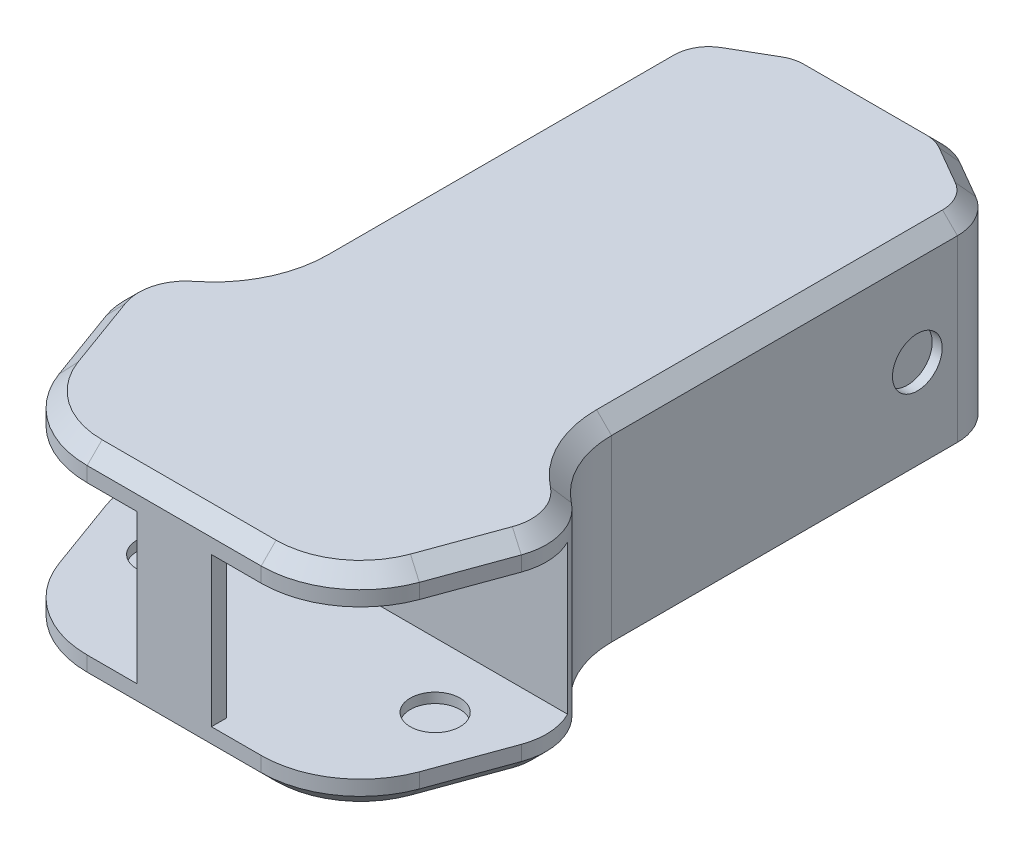
from build123d import *

# Parameters (mm, degrees)
BOSS_EXTRUDE1_DEPTH      = 21
BOSS_EXTRUDE1_DEPTH_BACK = 21
CUT_EXTRUDE2_DEPTH       = 150.699259177
CUT_EXTRUDE2_DEPTH_BACK  = 150.699259177
SKETCH3_W                = 38
SKETCH3_H                = 30
CHAMFER1_SIZE            = 3
BOSS_EXTRUDE2_REACH      = 154.528
SKETCH4_W                = 15
SKETCH4_H                = 3
SKETCH5_R                = 5
CUT_EXTRUDE3_DEPTH       = 2
SKETCH6_R                = 5
CUT_EXTRUDE4_DEPTH       = 2


with BuildPart() as part:
    # Sketch1 → Boss-Extrude1 (new, two sides: drawn at the far end of the back side and taken through both)
    with BuildSketch(Plane(origin=(0, 0, 0), x_dir=(1, 0, 0), z_dir=(0, 1, 0)).offset(-BOSS_EXTRUDE1_DEPTH_BACK)):
        with BuildLine():
            Line((12.320508076, 0), (-12.320508076, 0))
            ThreePointArc((-12.320508076, 0), (-14.908698527, -0.340741737), (-17.320508076, -1.339745962))
            Line((-17.320508076, -1.339745962), (-25, -5.773502692))
            ThreePointArc((-25, -5.773502692), (-28.660254038, -9.43375673), (-30, -14.43375673))
            Line((-30, -14.43375673), (-30, -84.024253192))
            ThreePointArc((-30, -84.024253192), (-32.022876143, -92.789127283), (-37.682301783, -99.780975904))
            ThreePointArc((-37.682301783, -99.780975904), (-42, -106.185164374), (-41.729898157, -113.904179391))
            Line((-41.729898157, -113.904179391), (-36.257575864, -128.939261324))
            ThreePointArc((-36.257575864, -128.939261324), (-28.928358883, -138.413184128), (-17.5, -142))
            Line((-17.5, -142), (17.5, -142))
            ThreePointArc((17.5, -142), (28.928358883, -138.413184128), (36.257575864, -128.939261324))
            Line((36.257575864, -128.939261324), (41.729898157, -113.904179391))
            ThreePointArc((41.729898157, -113.904179391), (42, -106.185164374), (37.682301783, -99.780975904))
            ThreePointArc((37.682301783, -99.780975904), (32.022876143, -92.789127283), (30, -84.024253192))
            Line((30, -84.024253192), (30, -14.43375673))
            ThreePointArc((30, -14.43375673), (28.660254038, -9.43375673), (25, -5.773502692))
            Line((25, -5.773502692), (17.320508076, -1.339745962))
            ThreePointArc((17.320508076, -1.339745962), (14.908698527, -0.340741737), (12.320508076, 0))
        make_face()
    extrude(amount=BOSS_EXTRUDE1_DEPTH + BOSS_EXTRUDE1_DEPTH_BACK)

    # Sketch3 → Cut-Extrude2 (cut, two sides: drawn at the far end of the back side and taken through both)
    with BuildSketch(Plane(origin=(0, 0, 0), x_dir=(0, 0, -1), z_dir=(1, 0, 0)).offset(-CUT_EXTRUDE2_DEPTH_BACK)):
        with Locations((-123, 0)):
            Rectangle(SKETCH3_W, SKETCH3_H)
    extrude(amount=CUT_EXTRUDE2_DEPTH + CUT_EXTRUDE2_DEPTH_BACK, mode=Mode.SUBTRACT)

    # Chamfer1
    chamfer1_edges = [part.edges().sort_by_distance(p)[0] for p in [
        (-42, -21, 106.185164374),
        (-38.99373701, -21, 121.421720357),
        (-28.928358883, -21, 138.413184128),
        (0, -21, 142),
        (28.928358883, -21, 138.413184128),
        (38.99373701, -21, 121.421720357),
        (42, -21, 106.185164374),
        (32.022876143, -21, 92.789127283),
        (30, -21, 49.229004961),
        (28.660254038, -21, 9.43375673),
        (21.160254038, -21, 3.556624327),
        (14.908698527, -21, 0.340741737),
        (0, -21, 0),
        (-14.908698527, -21, 0.340741737),
        (-21.160254038, -21, 3.556624327),
        (-28.660254038, -21, 9.43375673),
        (-30, -21, 49.229004961),
        (-32.022876143, -21, 92.789127283),
        (-30, 21, 49.229004961),
        (-28.660254038, 21, 9.43375673),
        (-21.160254038, 21, 3.556624327),
        (-14.908698527, 21, 0.340741737),
        (0, 21, 0),
        (14.908698527, 21, 0.340741737),
        (21.160254038, 21, 3.556624327),
        (28.660254038, 21, 9.43375673),
        (30, 21, 49.229004961),
        (32.022876143, 21, 92.789127283),
        (42, 21, 106.185164374),
        (38.99373701, 21, 121.421720357),
        (28.928358883, 21, 138.413184128),
        (0, 21, 142),
        (-28.928358883, 21, 138.413184128),
        (-38.99373701, 21, 121.421720357),
        (-42, 21, 106.185164374),
        (-32.022876143, 21, 92.789127283),
    ]]
    chamfer(chamfer1_edges, length=CHAMFER1_SIZE)

    # Sketch4 → Boss-Extrude2 (add, up to next)
    with BuildSketch(Plane(origin=(0, -15, 0), x_dir=(1, 0, 0), z_dir=(0, 1, 0)), mode=Mode.PRIVATE) as boss_extrude2_sk1:
        with Locations((0, -140.5)):
            Rectangle(SKETCH4_W, SKETCH4_H)
    boss_extrude2_tool1 = extrude(boss_extrude2_sk1.sketch, amount=BOSS_EXTRUDE2_REACH, mode=Mode.PRIVATE) - part.part
    add(boss_extrude2_tool1.solids().sort_by_distance((0, -15, 140.5))[0])

    # Sketch5 → Cut-Extrude3 (cut)
    with BuildSketch(Plane(origin=(0, -15, 0), x_dir=(1, 0, 0), z_dir=(0, 1, 0))):
        with Locations((-27.5, -117)):
            Circle(SKETCH5_R)
        with Locations((27.5, -117)):
            Circle(SKETCH5_R)
    extrude(amount=-CUT_EXTRUDE3_DEPTH, mode=Mode.SUBTRACT)

    # Sketch6 → Cut-Extrude4 (cut)
    with BuildSketch(Plane.ZY.offset(30)):
        with Locations((22.5, 0)):
            Circle(SKETCH6_R)
    cut_extrude4 = extrude(amount=-CUT_EXTRUDE4_DEPTH, mode=Mode.SUBTRACT)

    # Mirror1: Cut-Extrude4 across plane
    add(cut_extrude4.mirror(Plane(origin=(0, 0, 0), x_dir=(0, 0, 1), z_dir=(1, 0, 0))), mode=Mode.SUBTRACT)


solid = part.part
